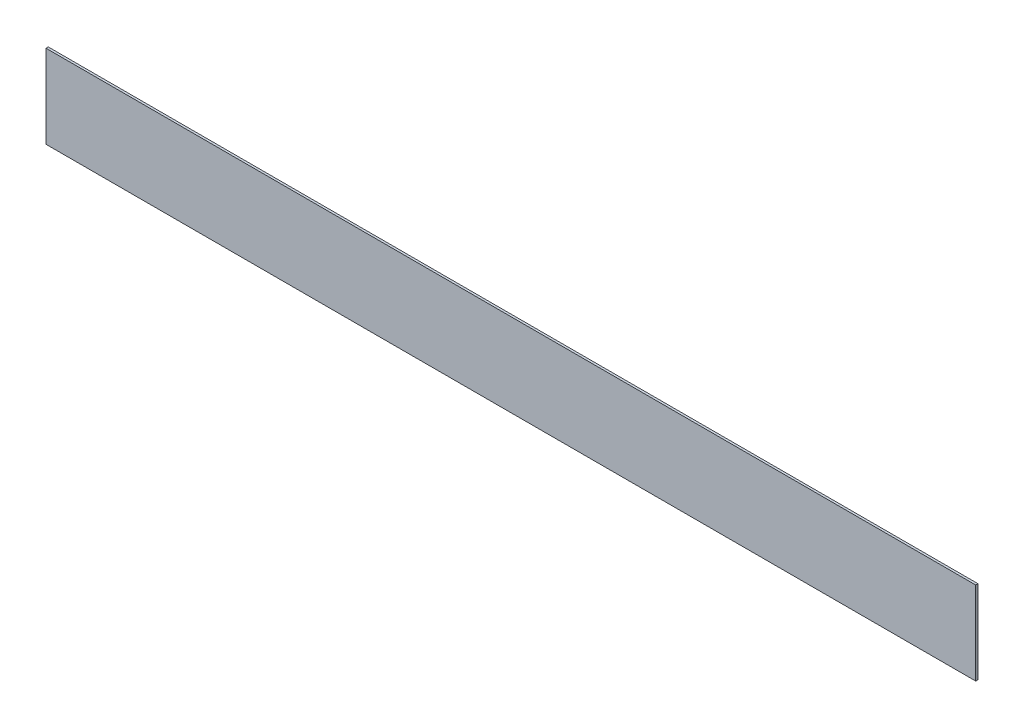
from build123d import *

# Parameters (mm, degrees)
SKETCH_1_W      = 2056
SKETCH_1_H      = 184
EXTRUDE_1_DEPTH = 5


with BuildPart() as part:
    # 草图1 → 凸台-拉伸1 (new body)
    with BuildSketch(Plane.XY):
        with Locations((1028, 92)):
            Rectangle(SKETCH_1_W, SKETCH_1_H)
    extrude(amount=EXTRUDE_1_DEPTH)


solid = part.part
